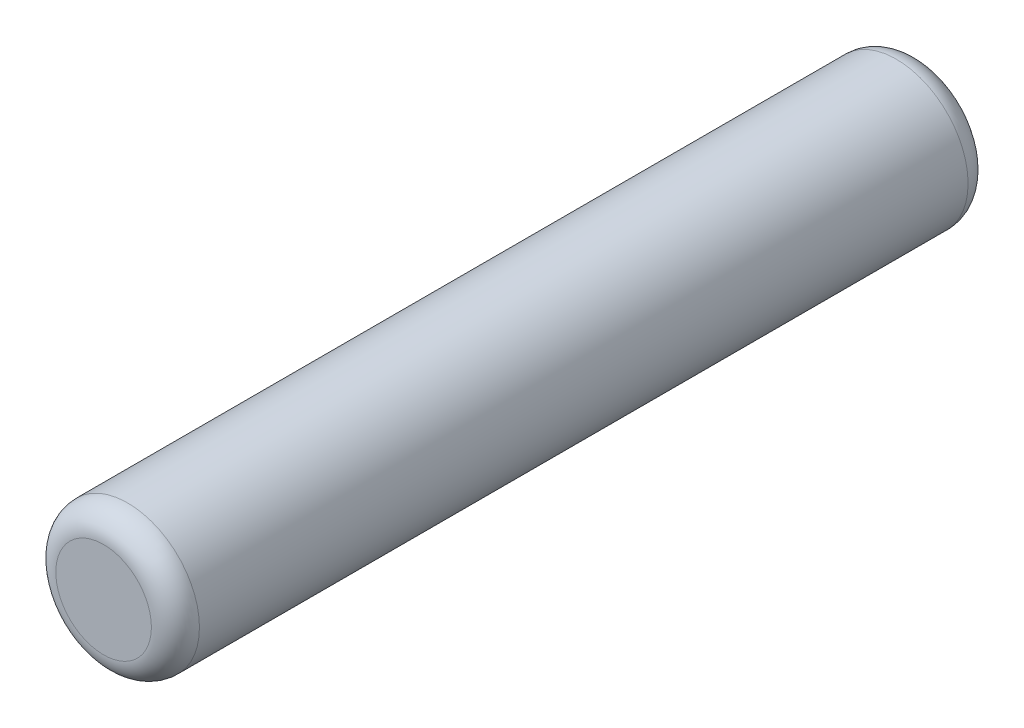
from build123d import *

# Parameters (mm, degrees)
SKETCH2_R           = 1.495
BOSS_EXTRUDE3_DEPTH = 17
FILLET2_R           = 0.5


with BuildPart() as part:
    # Sketch2 → Boss-Extrude3 (new body)
    with BuildSketch(Plane.XY):
        Circle(SKETCH2_R)
    extrude(amount=-BOSS_EXTRUDE3_DEPTH)

    # Fillet2
    fillet2_edges = [part.edges().sort_by_distance(p)[0] for p in [
        (-1.495, 0, 0),
        (-1.495, 0, -17),
    ]]
    fillet(fillet2_edges, radius=FILLET2_R)


solid = part.part
